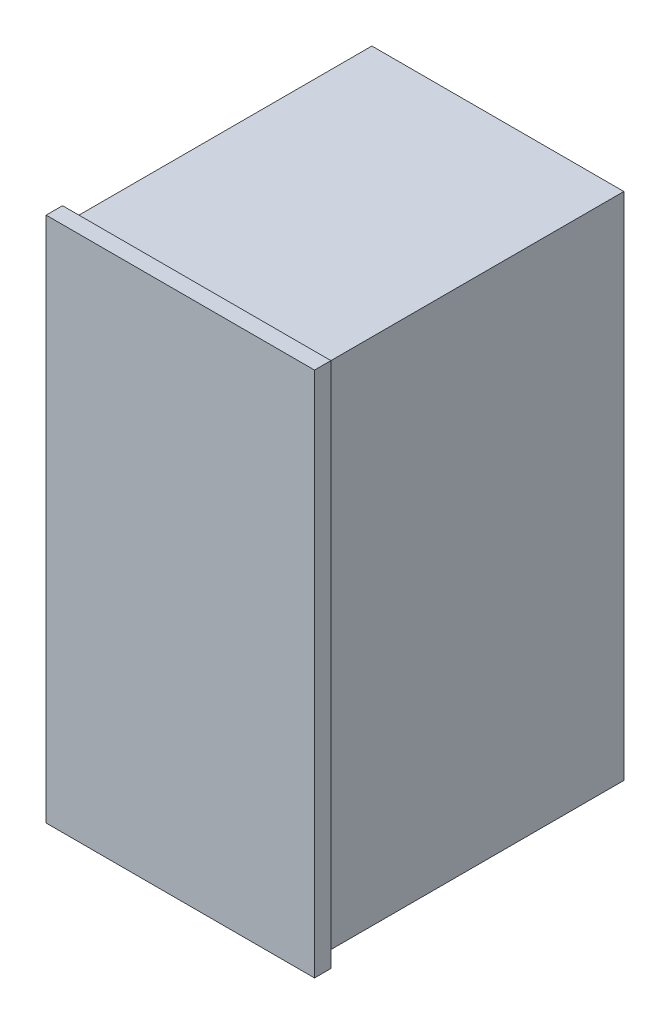
from build123d import *

# Parameters (mm, degrees)
SKETCH3_W                = 123
SKETCH3_H                = 147
BOSS_EXTRUDE1_DEPTH      = 249
BOSS_EXTRUDE2_DEPTH      = 253
BOSS_EXTRUDE2_DEPTH_BACK = 4
SKETCH4_W                = 131
SKETCH4_H                = 8


with BuildPart() as part:
    # Sketch3 → Boss-Extrude1 (new body)
    with BuildSketch(Plane(origin=(0, 0, 0), x_dir=(1, 0, 0), z_dir=(0, 1, 0))):
        with Locations((61.5, 73.5)):
            Rectangle(SKETCH3_W, SKETCH3_H)
    extrude(amount=BOSS_EXTRUDE1_DEPTH)

    # Sketch4 → Boss-Extrude2 (add, two sides: drawn at the far end of the back side and taken through both)
    with BuildSketch(Plane(origin=(0, 0, 0), x_dir=(1, 0, 0), z_dir=(0, 1, 0)).offset(-BOSS_EXTRUDE2_DEPTH_BACK)):
        with Locations((61.5, -4)):
            Rectangle(SKETCH4_W, SKETCH4_H)
    extrude(amount=BOSS_EXTRUDE2_DEPTH + BOSS_EXTRUDE2_DEPTH_BACK)


solid = part.part
